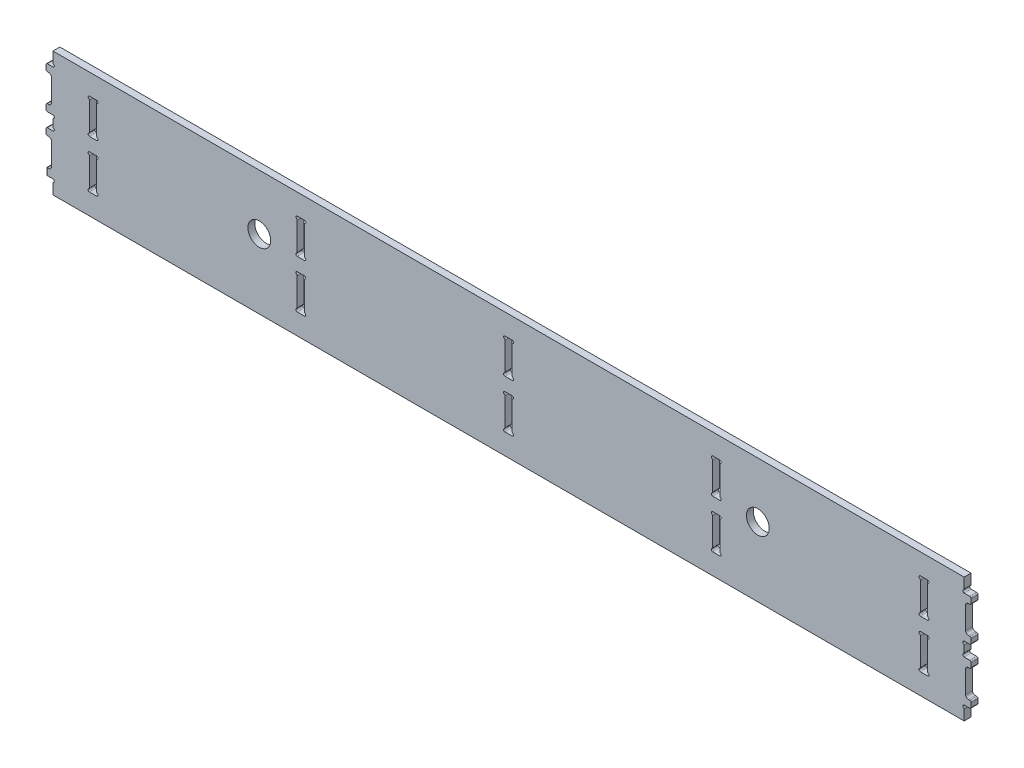
from build123d import *

# Parameters (mm, degrees)
SKETCH1_W               = 658
SKETCH1_H               = 90
BOSS_EXTRUDE1_DEPTH     = 5
SKETCH2_W               = 5
SKETCH2_H               = 30
BOSS_EXTRUDE2_DEPTH     = 5
SKETCH3_W               = 5
SKETCH3_H               = 20
CUT_EXTRUDE1_DEPTH      = 4
FILLET1_R               = 2
SKETCH4_R               = 1
CUT_EXTRUDE2_DEPTH      = 346.949418268
FILLET2_R               = 1
SKETCH5_W               = 5.2
SKETCH5_H               = 25.2
CUT_EXTRUDE3_DEPTH      = 346.949418268
SKETCH6_R               = 1
CUT_EXTRUDE4_DEPTH      = 346.949418268
FILLET3_R               = 1
CUT_EXTRUDE5_DEPTH      = 673.922182534
CUT_EXTRUDE5_DEPTH_BACK = 673.922182534
SKETCH7_R               = 8.25


with BuildPart() as part:
    # Sketch1 → Boss-Extrude1 (new body)
    with BuildSketch(Plane.XY):
        with Locations((0, 45)):
            Rectangle(SKETCH1_W, SKETCH1_H)
    extrude(amount=BOSS_EXTRUDE1_DEPTH)

    # Sketch2 → Boss-Extrude2 (add)
    with BuildSketch(Plane.ZY.offset(329)):
        with Locations((2.5, 65)):
            Rectangle(SKETCH2_W, SKETCH2_H)
        with Locations((2.5, 25)):
            Rectangle(SKETCH2_W, SKETCH2_H)
    boss_extrude2 = extrude(amount=BOSS_EXTRUDE2_DEPTH)

    # Sketch3 → Cut-Extrude1 (cut)
    with BuildSketch(Plane.ZY.offset(334)):
        with Locations((2.5, 65)):
            Rectangle(SKETCH3_W, SKETCH3_H)
        with Locations((2.5, 25)):
            Rectangle(SKETCH3_W, SKETCH3_H)
    cut_extrude1 = extrude(amount=-CUT_EXTRUDE1_DEPTH, mode=Mode.SUBTRACT)

    # Mirror1: Boss-Extrude2, Cut-Extrude1 across plane
    add(boss_extrude2.mirror(Plane(origin=(0, 0, 0), x_dir=(0, 0, 1), z_dir=(1, 0, 0))))
    add(cut_extrude1.mirror(Plane(origin=(0, 0, 0), x_dir=(0, 0, 1), z_dir=(1, 0, 0))), mode=Mode.SUBTRACT)

    # Fillet1
    fillet1_edges = [part.edges().sort_by_distance(p)[0] for p in [
        (330, 55, 2.5),
        (330, 75, 2.5),
        (330, 15, 2.5),
        (330, 35, 2.5),
        (-330, 75, 2.5),
        (-330, 55, 2.5),
        (-330, 35, 2.5),
        (-330, 15, 2.5),
    ]]
    fillet(fillet1_edges, radius=FILLET1_R)

    # Sketch4 → Cut-Extrude2 (cut, through all)
    with BuildSketch(Plane(origin=(0, 0, 0), x_dir=(-1, 0, 0), z_dir=(0, 0, -1))):
        with Locations((-329, 81)):
            Circle(SKETCH4_R)
        with Locations((-329, 49)):
            Circle(SKETCH4_R)
        with Locations((-329, 41)):
            Circle(SKETCH4_R)
        with Locations((-329, 9)):
            Circle(SKETCH4_R)
        with Locations((329, 9)):
            Circle(SKETCH4_R)
        with Locations((329, 41)):
            Circle(SKETCH4_R)
        with Locations((329, 49)):
            Circle(SKETCH4_R)
        with Locations((329, 81)):
            Circle(SKETCH4_R)
    extrude(amount=-CUT_EXTRUDE2_DEPTH, mode=Mode.SUBTRACT)

    # Fillet2
    fillet2_edges = [part.edges().sort_by_distance(p)[0] for p in [
        (-334, 12.5, 5),
        (-334, 10, 2.5),
        (-334, 12.5, 0),
        (-334, 15, 2.5),
        (-329, 8, 2.5),
        (-334, 35, 2.5),
        (-334, 40, 2.5),
        (-329, 42, 2.5),
        (-329, 48, 2.5),
        (-334, 50, 2.5),
        (-334, 55, 2.5),
        (-334, 75, 2.5),
        (-334, 80, 2.5),
        (-329, 82, 2.5),
        (329, 8, 2.5),
        (334, 10, 2.5),
        (334, 15, 2.5),
        (334, 35, 2.5),
        (334, 40, 2.5),
        (329, 42, 2.5),
        (329, 48, 2.5),
        (334, 50, 2.5),
        (334, 55, 2.5),
        (334, 75, 2.5),
        (334, 80, 2.5),
        (329, 82, 2.5),
    ]]
    fillet(fillet2_edges, radius=FILLET2_R)

    # Sketch5 → Cut-Extrude3 (cut, through all)
    with BuildSketch(Plane.XY.offset(5)):
        with Locations((0, 62.4)):
            Rectangle(SKETCH5_W, SKETCH5_H)
        with Locations((0, 27.6)):
            Rectangle(SKETCH5_W, SKETCH5_H)
        with Locations((150, 62.4)):
            Rectangle(SKETCH5_W, SKETCH5_H)
        with Locations((150, 27.6)):
            Rectangle(SKETCH5_W, SKETCH5_H)
        with Locations((300, 62.4)):
            Rectangle(SKETCH5_W, SKETCH5_H)
        with Locations((300, 27.6)):
            Rectangle(SKETCH5_W, SKETCH5_H)
        with Locations((-300, 27.6)):
            Rectangle(SKETCH5_W, SKETCH5_H)
        with Locations((-300, 62.4)):
            Rectangle(SKETCH5_W, SKETCH5_H)
        with Locations((-150, 27.6)):
            Rectangle(SKETCH5_W, SKETCH5_H)
        with Locations((-150, 62.4)):
            Rectangle(SKETCH5_W, SKETCH5_H)
    extrude(amount=-CUT_EXTRUDE3_DEPTH, mode=Mode.SUBTRACT)

    # Sketch6 → Cut-Extrude4 (cut, through all)
    with BuildSketch(Plane.XY.offset(5)):
        with Locations((-302.6, 74)):
            Circle(SKETCH6_R)
        with Locations((-297.4, 74)):
            Circle(SKETCH6_R)
        with Locations((-302.6, 50.8)):
            Circle(SKETCH6_R)
        with Locations((-297.4, 50.8)):
            Circle(SKETCH6_R)
        with Locations((-302.6, 39.2)):
            Circle(SKETCH6_R)
        with Locations((-297.4, 39.2)):
            Circle(SKETCH6_R)
        with Locations((-302.6, 16)):
            Circle(SKETCH6_R)
        with Locations((-297.4, 16)):
            Circle(SKETCH6_R)
        with Locations((-152.6, 74)):
            Circle(SKETCH6_R)
        with Locations((-147.4, 74)):
            Circle(SKETCH6_R)
        with Locations((-152.6, 50.8)):
            Circle(SKETCH6_R)
        with Locations((-147.4, 50.8)):
            Circle(SKETCH6_R)
        with Locations((-152.6, 39.2)):
            Circle(SKETCH6_R)
        with Locations((-147.4, 39.2)):
            Circle(SKETCH6_R)
        with Locations((-152.6, 16)):
            Circle(SKETCH6_R)
        with Locations((-147.4, 16)):
            Circle(SKETCH6_R)
        with Locations((-2.6, 74)):
            Circle(SKETCH6_R)
        with Locations((2.6, 74)):
            Circle(SKETCH6_R)
        with Locations((-2.6, 50.8)):
            Circle(SKETCH6_R)
        with Locations((2.6, 50.8)):
            Circle(SKETCH6_R)
        with Locations((-2.6, 39.2)):
            Circle(SKETCH6_R)
        with Locations((2.6, 39.2)):
            Circle(SKETCH6_R)
        with Locations((-2.6, 16)):
            Circle(SKETCH6_R)
        with Locations((2.6, 16)):
            Circle(SKETCH6_R)
        with Locations((147.4, 74)):
            Circle(SKETCH6_R)
        with Locations((152.6, 74)):
            Circle(SKETCH6_R)
        with Locations((147.4, 50.8)):
            Circle(SKETCH6_R)
        with Locations((152.6, 50.8)):
            Circle(SKETCH6_R)
        with Locations((147.4, 39.2)):
            Circle(SKETCH6_R)
        with Locations((152.6, 39.2)):
            Circle(SKETCH6_R)
        with Locations((147.4, 16)):
            Circle(SKETCH6_R)
        with Locations((152.6, 16)):
            Circle(SKETCH6_R)
        with Locations((297.4, 74)):
            Circle(SKETCH6_R)
        with Locations((302.6, 74)):
            Circle(SKETCH6_R)
        with Locations((297.4, 50.8)):
            Circle(SKETCH6_R)
        with Locations((302.6, 50.8)):
            Circle(SKETCH6_R)
        with Locations((297.4, 39.2)):
            Circle(SKETCH6_R)
        with Locations((302.6, 39.2)):
            Circle(SKETCH6_R)
        with Locations((297.4, 16)):
            Circle(SKETCH6_R)
        with Locations((302.6, 16)):
            Circle(SKETCH6_R)
    extrude(amount=-CUT_EXTRUDE4_DEPTH, mode=Mode.SUBTRACT)

    # Fillet3
    fillet3_edges = [part.edges().sort_by_distance(p)[0] for p in [
        (-152.6, 38.2, 2.5),
        (-152.6, 17, 2.5),
        (-147.4, 38.2, 2.5),
        (-302.6, 73, 2.5),
        (-302.6, 51.8, 2.5),
        (-297.4, 73, 2.5),
        (302.6, 38.2, 2.5),
        (302.6, 73, 2.5),
        (152.6, 38.2, 2.5),
        (152.6, 73, 2.5),
        (-302.6, 38.2, 2.5),
        (-302.6, 17, 2.5),
        (-297.4, 38.2, 2.5),
        (2.6, 38.2, 2.5),
        (-152.6, 51.8, 2.5),
        (-152.6, 73, 2.5),
        (-147.4, 73, 2.5),
        (2.6, 73, 2.5),
        (-2.6, 17, 2.5),
        (2.6, 17, 2.5),
        (147.4, 73, 2.5),
        (-2.6, 51.8, 2.5),
        (2.6, 51.8, 2.5),
        (-2.6, 38.2, 2.5),
        (147.4, 17, 2.5),
        (152.6, 17, 2.5),
        (297.4, 73, 2.5),
        (147.4, 51.8, 2.5),
        (152.6, 51.8, 2.5),
        (147.4, 38.2, 2.5),
        (-297.4, 17, 2.5),
        (-297.4, 51.8, 2.5),
        (-147.4, 17, 2.5),
        (-2.6, 73, 2.5),
        (-147.4, 51.8, 2.5),
        (297.4, 17, 2.5),
        (302.6, 17, 2.5),
        (297.4, 51.8, 2.5),
        (302.6, 51.8, 2.5),
        (297.4, 38.2, 2.5),
    ]]
    fillet(fillet3_edges, radius=FILLET3_R)

    # Sketch7 → Cut-Extrude5 (cut, two sides: drawn at the far end of the back side and taken through both)
    with BuildSketch(Plane(origin=(-179.114802645, -345.330291909, 0), x_dir=(-1, 0, 0), z_dir=(0, 0, -1)).offset(-CUT_EXTRUDE5_DEPTH_BACK)):
        with Locations(Location((-359.114802643, 395.330291909, 0), (0, 0, 180))):
            Circle(SKETCH7_R)
        with Locations(Location((0.885197357, 395.330291909, 0), (0, 0, 180))):
            Circle(SKETCH7_R)
    extrude(amount=CUT_EXTRUDE5_DEPTH + CUT_EXTRUDE5_DEPTH_BACK, mode=Mode.SUBTRACT)


solid = part.part
